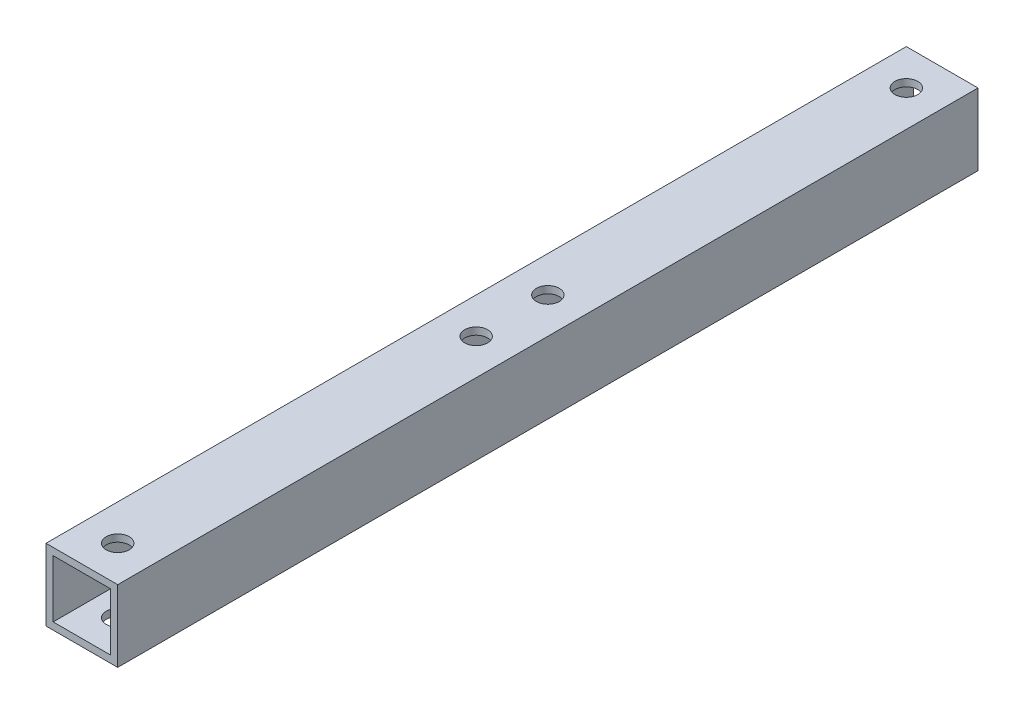
from build123d import *

# Parameters (mm, degrees)
SKETCH_282_W          = 10
SKETCH_282_H          = 10
SKETCH_282_W_2        = 8
SKETCH_282_H_2        = 8
EXTRUDE_339_DEPTH     = 120
SKETCH_411_R          = 1.6
CUT_EXTRUDE_780_DEPTH = 121.519707932


with BuildPart() as part:
    # Sketch 282 → Extrude 339 (new body)
    with BuildSketch(Plane.XY):
        Rectangle(SKETCH_282_W, SKETCH_282_H)
        Rectangle(SKETCH_282_W_2, SKETCH_282_H_2, mode=Mode.SUBTRACT)
    extrude(amount=EXTRUDE_339_DEPTH)

    # Sketch 411 → Cut-Extrude 780 (cut, through all)
    with BuildSketch(Plane(origin=(0, 5, 0), x_dir=(1, 0, 0), z_dir=(0, 1, 0))):
        with Locations(Location((0, -5, 0), (0, 0, 270))):
            Circle(SKETCH_411_R)
        with Locations(Location((0, -55, 0), (0, 0, 270))):
            Circle(SKETCH_411_R)
        with Locations(Location((0, -115, 0), (0, 0, 270))):
            Circle(SKETCH_411_R)
        with Locations(Location((0, -65, 0), (0, 0, 270))):
            Circle(SKETCH_411_R)
    extrude(amount=-CUT_EXTRUDE_780_DEPTH, mode=Mode.SUBTRACT)


solid = part.part
